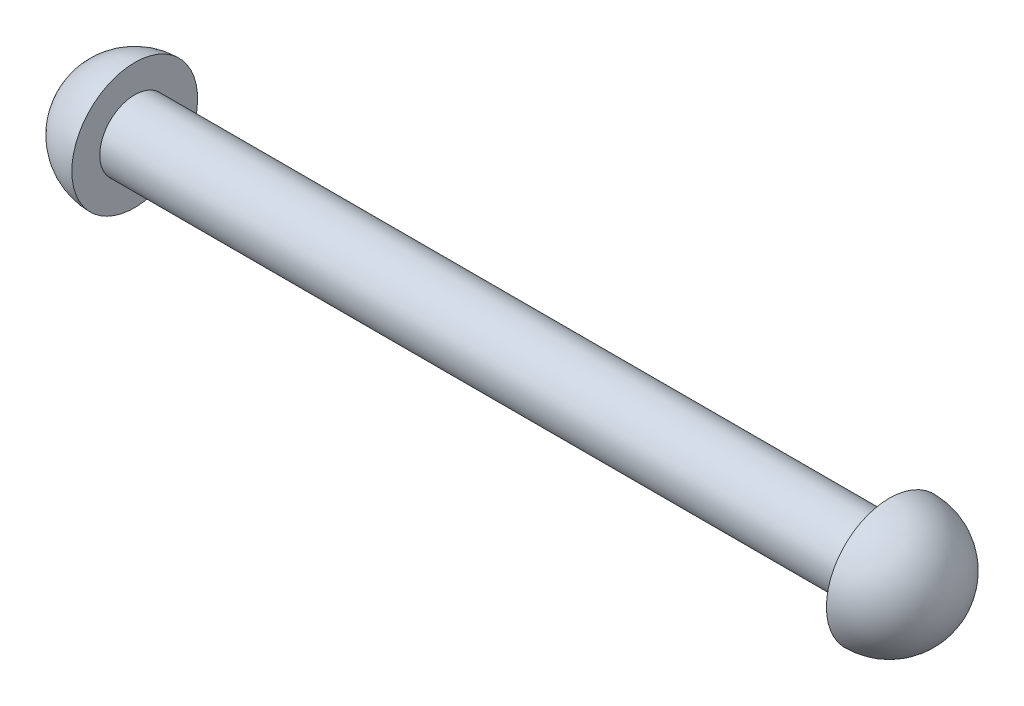
from build123d import *

# Parameters (mm, degrees)
SKETCH1_W = 68.58
SKETCH1_H = 3.175


with BuildPart() as part:
    # Sketch1 → Revolve1 (revolve)
    with BuildSketch(Plane.XY):
        with BuildLine():
            Line((-34.29, 1.5875), (-34.29, 4.1275))
            ThreePointArc((-34.29, 4.1275), (-38.331115254, 2.453615254), (-40.005, -1.5875))
            Line((-40.005, -1.5875), (-34.29, -1.5875))
            Line((-34.29, -1.5875), (-34.29, 1.5875))
        make_face()
        Rectangle(SKETCH1_W, SKETCH1_H)
        with BuildLine():
            ThreePointArc((34.29, 4.1275), (38.331115254, 2.453615254), (40.005, -1.5875))
            Line((40.005, -1.5875), (34.29, -1.5875))
            Line((34.29, -1.5875), (34.29, 1.5875))
            Line((34.29, 1.5875), (34.29, 4.1275))
        make_face()
    revolve(axis=Axis((-34.29, -1.5875, 0), (1, 0, 0)))


solid = part.part
